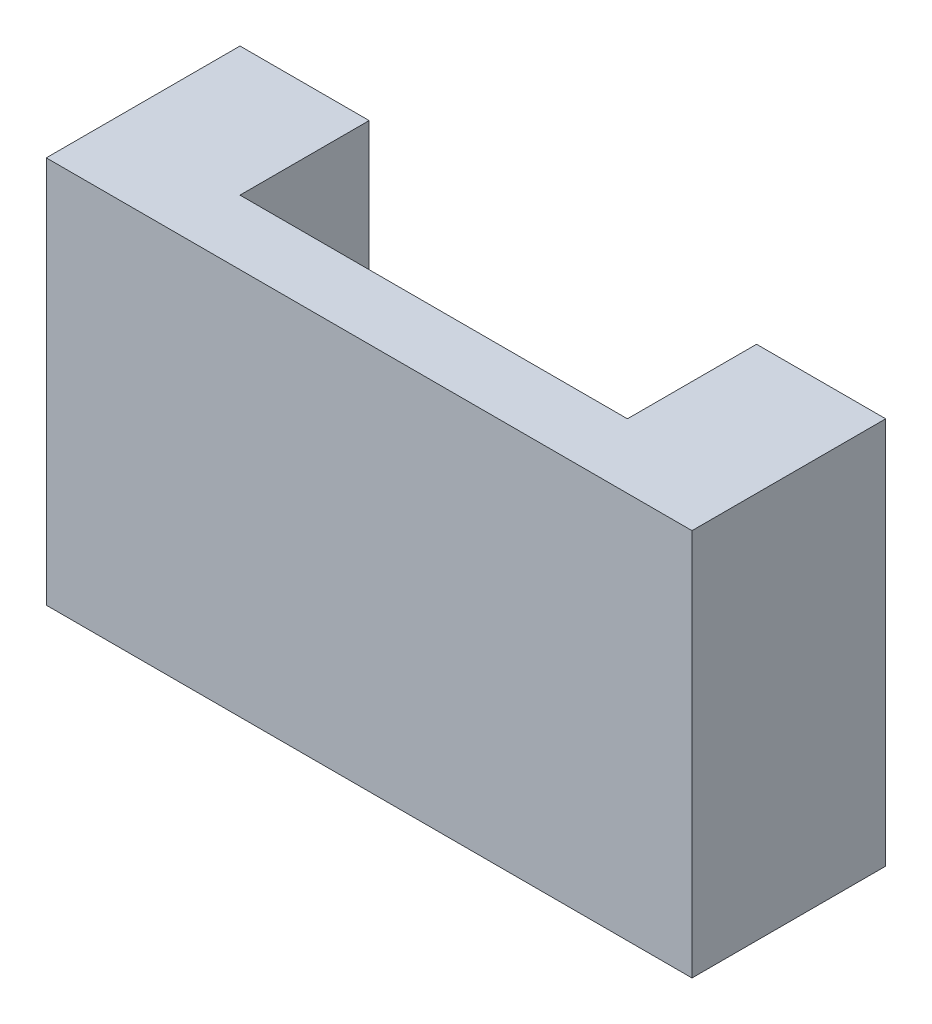
from build123d import *

# Parameters (mm, degrees)
BOSS_EXTRUDE1_DEPTH = 30


with BuildPart() as part:
    # Sketch1 → Boss-Extrude1 (new body)
    with BuildSketch(Plane(origin=(0, 0, 0), x_dir=(1, 0, 0), z_dir=(0, 1, 0))):
        Polygon((-25, 0), (-15, 0), (-15, -10), (15, -10), (15, 0), (25, 0), (25, -15), (-25, -15), align=None)
    extrude(amount=BOSS_EXTRUDE1_DEPTH)


solid = part.part
